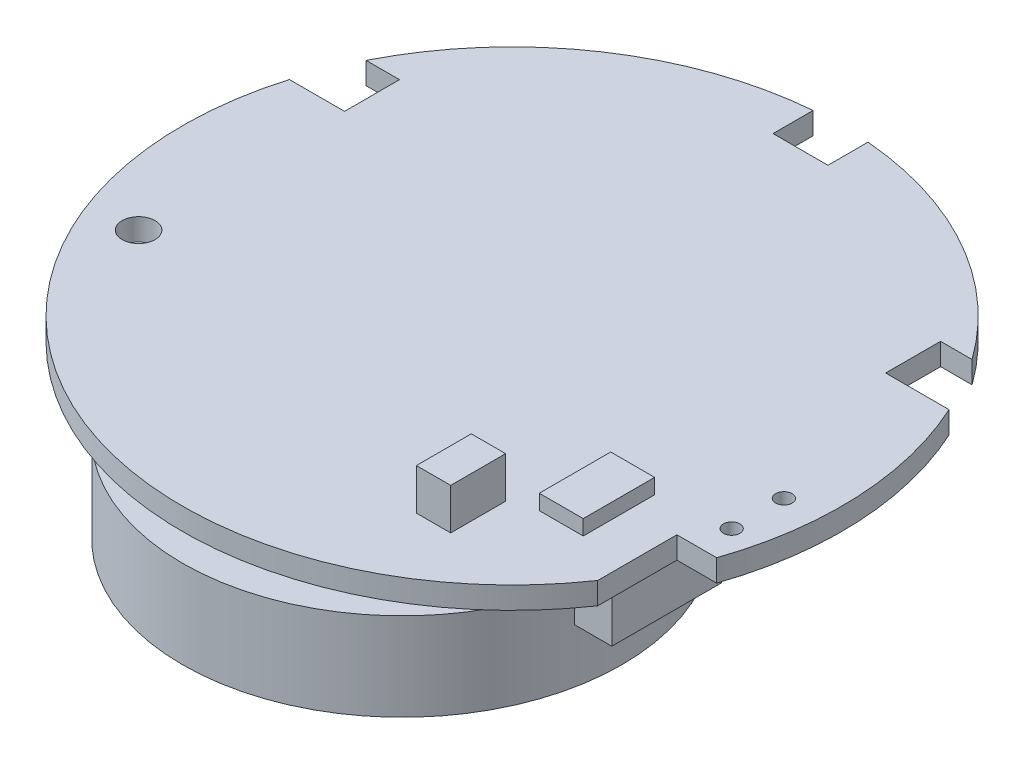
from build123d import *

# Parameters (mm, degrees)
SKETCH1_R           = 12
BOSS_EXTRUDE1_DEPTH = 0.8
CUT_EXTRUDE1_START  = -0.8
CUT_EXTRUDE1_DEPTH  = 0.8
SKETCH3_R           = 0.6
SKETCH3_R_2         = 0.3
CUT_EXTRUDE2_DEPTH  = 0.8
SKETCH4_W           = 8
SKETCH4_H           = 4
BOSS_EXTRUDE2_DEPTH = 1
SKETCH5_R           = 8
BOSS_EXTRUDE3_DEPTH = 3.2
SKETCH6_W           = 1.35
SKETCH6_H           = 4
BOSS_EXTRUDE4_DEPTH = 1.8
SKETCH7_W           = 1.25
SKETCH7_H           = 2
BOSS_EXTRUDE5_DEPTH = 1.5
SKETCH8_W           = 1.6
SKETCH8_H           = 2.6
BOSS_EXTRUDE6_DEPTH = 0.55


with BuildPart() as part:
    # Sketch1 → Boss-Extrude1 (new body)
    with BuildSketch(Plane(origin=(0, 0, 0), x_dir=(1, 0, 0), z_dir=(0, 1, 0))):
        with Locations(Location((0, 0, 0), (0, 0, 270))):
            Circle(SKETCH1_R)
    extrude(amount=BOSS_EXTRUDE1_DEPTH)

    # Sketch2 → Cut-Extrude1 (cut)
    with BuildSketch(Plane(origin=(0, 0.8, 0), x_dir=(1, 0, 0), z_dir=(0, 1, 0)).offset(CUT_EXTRUDE1_START)):
        with BuildLine():
            Line((-11.508257905, 3.4), (-9.5, 3.4))
            Line((-9.5, 3.4), (-9.5, 5.4))
            Line((-9.5, 5.4), (-10.71634266, 5.4))
            ThreePointArc((-10.71634266, 5.4), (-11.157204738, 4.417780261), (-11.508257905, 3.4))
        make_face()
        with BuildLine():
            ThreePointArc((0, 12), (-0.500435352, 11.989560645), (-1, 11.958260743))
            Line((-1, 11.958260743), (-1, 10.5))
            Line((-1, 10.5), (1, 10.5))
            Line((1, 10.5), (1, 11.958260743))
            ThreePointArc((1, 11.958260743), (0.500435352, 11.989560645), (0, 12))
        make_face()
        with BuildLine():
            Line((8.6, 5), (10.908712115, 5))
            ThreePointArc((10.908712115, 5), (10.376053526, 6.028060486), (9.746794345, 7))
            Line((9.746794345, 7), (8.6, 7))
            Line((8.6, 7), (8.6, 5))
        make_face()
        with BuildLine():
            Line((9.9, -3.9), (9.9, -6.781592733))
            ThreePointArc((9.9, -6.781592733), (10.721534718, -5.389683969), (11.348568192, -3.9))
            Line((11.348568192, -3.9), (9.9, -3.9))
        make_face()
    extrude(amount=CUT_EXTRUDE1_DEPTH, mode=Mode.SUBTRACT)

    # Sketch3 → Cut-Extrude2 (cut)
    with BuildSketch(Plane(origin=(0, 0.8, 0), x_dir=(1, 0, 0), z_dir=(0, 1, 0))):
        with Locations(Location((-9.505920047, -4.093895952, 0), (0, 0, 270))):
            Circle(SKETCH3_R)
        with Locations(Location((10.702676663, -2.70819354, 0), (0, 0, 270))):
            Circle(SKETCH3_R_2)
        with Locations(Location((10.699796483, -0.804521739, 0), (0, 0, 270))):
            Circle(SKETCH3_R_2)
    extrude(amount=-CUT_EXTRUDE2_DEPTH, mode=Mode.SUBTRACT)

    # Sketch4 → Boss-Extrude2 (add)
    with BuildSketch(Plane(origin=(0, 0, 0), x_dir=(-1, 0, 0), z_dir=(0, -1, 0))):
        with Locations((0, -4)):
            Rectangle(SKETCH4_W, SKETCH4_H)
    extrude(amount=BOSS_EXTRUDE2_DEPTH)

    # Sketch5 → Boss-Extrude3 (add)
    with BuildSketch(Plane(origin=(0, -1, 0), x_dir=(-1, 0, 0), z_dir=(0, -1, 0))):
        with Locations(Location((0, -4, 0), (0, 0, 90))):
            Circle(SKETCH5_R)
    extrude(amount=BOSS_EXTRUDE3_DEPTH)

    # Sketch6 → Boss-Extrude4 (add)
    with BuildSketch(Plane.XZ):
        with Locations((8.955, 4)):
            Rectangle(SKETCH6_W, SKETCH6_H)
    extrude(amount=BOSS_EXTRUDE4_DEPTH)

    # Sketch7 → Boss-Extrude5 (add)
    with BuildSketch(Plane(origin=(0, 0.8, 0), x_dir=(1, 0, 0), z_dir=(0, 1, 0))):
        with Locations((5.1, -6.96)):
            Rectangle(SKETCH7_W, SKETCH7_H)
    extrude(amount=BOSS_EXTRUDE5_DEPTH)

    # Sketch8 → Boss-Extrude6 (add)
    with BuildSketch(Plane(origin=(0, 0.8, 0), x_dir=(1, 0, 0), z_dir=(0, 1, 0))):
        with Locations((7.435, -4.345)):
            Rectangle(SKETCH8_W, SKETCH8_H)
    extrude(amount=BOSS_EXTRUDE6_DEPTH)


solid = part.part
